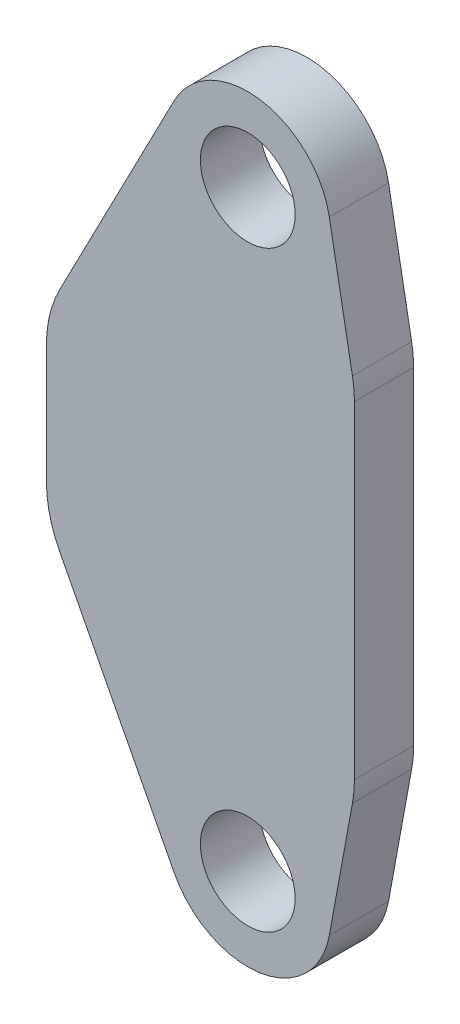
from build123d import *

# Parameters (mm, degrees)
SKETCH1_R           = 4
BOSS_EXTRUDE1_DEPTH = 5


with BuildPart() as part:
    # Sketch1 → Boss-Extrude1 (new body)
    # profile 1 of 11: a face of its own
    with BuildSketch(Plane.XY):
        with BuildLine():
            ThreePointArc((7, 25), (-1.657831686, 18.199147546), (-6.214741171, 28.221333912))
            Line((-6.214741171, 28.221333912), (-15.878201673, 9.578154573))
            ThreePointArc((-15.878201673, 9.578154573), (-16.715503506, 7.344579965), (-17, 4.976248984))
            Line((-17, 4.976248984), (-17, -4.976248984))
            ThreePointArc((-17, -4.976248984), (-16.715503506, -7.344579965), (-15.878201673, -9.578154573))
            Line((-15.878201673, -9.578154573), (-6.214741171, -28.221333912))
            ThreePointArc((-6.214741171, -28.221333912), (-1.657831686, -18.199147546), (7, -25))
            ThreePointArc((7, -25), (6.97123748, -25.633914815), (6.885186288, -26.262620205))
            Line((6.885186288, -26.262620205), (8.835980411, -15.624757058))
            ThreePointArc((8.835980411, -15.624757058), (8.958910686, -14.7266065), (9, -13.821013908))
            Line((9, -13.821013908), (9, 13.821013908))
            ThreePointArc((9, 13.821013908), (8.958910686, 14.7266065), (8.835980411, 15.624757058))
            Line((8.835980411, 15.624757058), (6.885186288, 26.262620205))
            ThreePointArc((6.885186288, 26.262620205), (6.97123748, 25.633914815), (7, 25))
        make_face()
    # profile 2 of 11: a face of its own
    with BuildSketch(Plane.XY):
        with BuildLine():
            ThreePointArc((6.885186288, 26.262620205), (1.035139609, 31.923040227), (-6.214741171, 28.221333912))
            ThreePointArc((-6.214741171, 28.221333912), (-1.657831686, 18.199147546), (7, 25))
            ThreePointArc((7, 25), (6.97123748, 25.633914815), (6.885186288, 26.262620205))
        make_face()
        with Locations((0, 25)):
            Circle(SKETCH1_R, mode=Mode.SUBTRACT)
    # profile 3 of 11: a face of its own
    with BuildSketch(Plane.XY):
        with BuildLine():
            ThreePointArc((6.885186288, 26.262620205), (1.035139609, 31.923040227), (-6.214741171, 28.221333912))
            ThreePointArc((-6.214741171, 28.221333912), (-1.657831686, 18.199147546), (7, 25))
            ThreePointArc((7, 25), (6.97123748, 25.633914815), (6.885186288, 26.262620205))
        make_face()
        with Locations((0, 25)):
            Circle(SKETCH1_R, mode=Mode.SUBTRACT)
    # profile 4 of 11: a face of its own
    with BuildSketch(Plane.XY):
        with BuildLine():
            ThreePointArc((6.885186288, 26.262620205), (1.035139609, 31.923040227), (-6.214741171, 28.221333912))
            ThreePointArc((-6.214741171, 28.221333912), (-1.657831686, 18.199147546), (7, 25))
            ThreePointArc((7, 25), (6.97123748, 25.633914815), (6.885186288, 26.262620205))
        make_face()
        with Locations((0, 25)):
            Circle(SKETCH1_R, mode=Mode.SUBTRACT)
    # profile 5 of 11: a face of its own
    with BuildSketch(Plane.XY):
        with BuildLine():
            ThreePointArc((6.885186288, 26.262620205), (1.035139609, 31.923040227), (-6.214741171, 28.221333912))
            ThreePointArc((-6.214741171, 28.221333912), (-1.657831686, 18.199147546), (7, 25))
            ThreePointArc((7, 25), (6.97123748, 25.633914815), (6.885186288, 26.262620205))
        make_face()
        with Locations((0, 25)):
            Circle(SKETCH1_R, mode=Mode.SUBTRACT)
    # profile 6 of 11: a face of its own
    with BuildSketch(Plane.XY):
        with BuildLine():
            ThreePointArc((6.885186288, 26.262620205), (1.035139609, 31.923040227), (-6.214741171, 28.221333912))
            ThreePointArc((-6.214741171, 28.221333912), (-1.657831686, 18.199147546), (7, 25))
            ThreePointArc((7, 25), (6.97123748, 25.633914815), (6.885186288, 26.262620205))
        make_face()
        with Locations((0, 25)):
            Circle(SKETCH1_R, mode=Mode.SUBTRACT)
    # profile 7 of 11: a face of its own
    with BuildSketch(Plane.XY):
        with BuildLine():
            ThreePointArc((7, -25), (-1.657831686, -18.199147546), (-6.214741171, -28.221333912))
            ThreePointArc((-6.214741171, -28.221333912), (1.035139609, -31.923040227), (6.885186288, -26.262620205))
            ThreePointArc((6.885186288, -26.262620205), (6.97123748, -25.633914815), (7, -25))
        make_face()
        with Locations((0, -25)):
            Circle(SKETCH1_R, mode=Mode.SUBTRACT)
    # profile 8 of 11: a face of its own
    with BuildSketch(Plane.XY):
        with BuildLine():
            ThreePointArc((7, -25), (-1.657831686, -18.199147546), (-6.214741171, -28.221333912))
            ThreePointArc((-6.214741171, -28.221333912), (1.035139609, -31.923040227), (6.885186288, -26.262620205))
            ThreePointArc((6.885186288, -26.262620205), (6.97123748, -25.633914815), (7, -25))
        make_face()
        with Locations((0, -25)):
            Circle(SKETCH1_R, mode=Mode.SUBTRACT)
    # profile 9 of 11: a face of its own
    with BuildSketch(Plane.XY):
        with BuildLine():
            ThreePointArc((7, -25), (-1.657831686, -18.199147546), (-6.214741171, -28.221333912))
            ThreePointArc((-6.214741171, -28.221333912), (1.035139609, -31.923040227), (6.885186288, -26.262620205))
            ThreePointArc((6.885186288, -26.262620205), (6.97123748, -25.633914815), (7, -25))
        make_face()
        with Locations((0, -25)):
            Circle(SKETCH1_R, mode=Mode.SUBTRACT)
    # profile 10 of 11: a face of its own
    with BuildSketch(Plane.XY):
        with BuildLine():
            ThreePointArc((7, -25), (-1.657831686, -18.199147546), (-6.214741171, -28.221333912))
            ThreePointArc((-6.214741171, -28.221333912), (1.035139609, -31.923040227), (6.885186288, -26.262620205))
            ThreePointArc((6.885186288, -26.262620205), (6.97123748, -25.633914815), (7, -25))
        make_face()
        with Locations((0, -25)):
            Circle(SKETCH1_R, mode=Mode.SUBTRACT)
    # profile 11 of 11: a face of its own
    with BuildSketch(Plane.XY):
        with BuildLine():
            ThreePointArc((7, -25), (-1.657831686, -18.199147546), (-6.214741171, -28.221333912))
            ThreePointArc((-6.214741171, -28.221333912), (1.035139609, -31.923040227), (6.885186288, -26.262620205))
            ThreePointArc((6.885186288, -26.262620205), (6.97123748, -25.633914815), (7, -25))
        make_face()
        with Locations((0, -25)):
            Circle(SKETCH1_R, mode=Mode.SUBTRACT)
    extrude(amount=BOSS_EXTRUDE1_DEPTH)


solid = part.part
